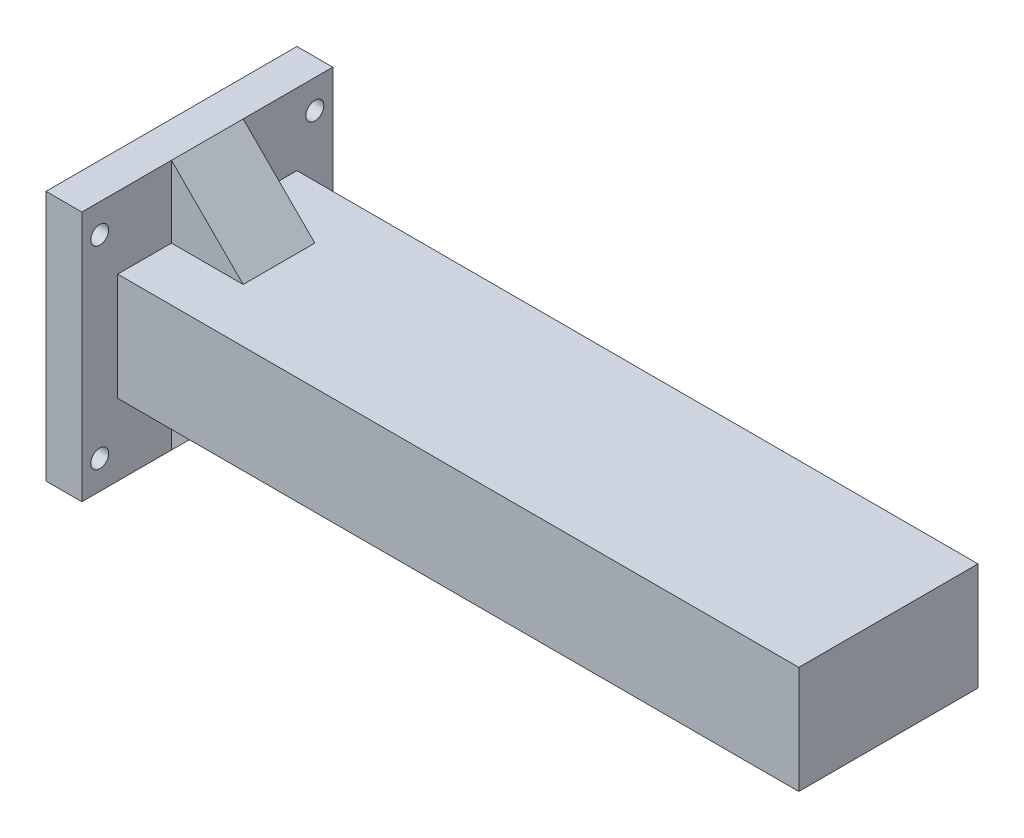
from build123d import *

# Parameters (mm, degrees)
BOSS_EXTRUDE1_DEPTH         = 12.5
SKETCH2_W                   = 5
SKETCH2_H                   = 35
BOSS_EXTRUDE2_DEPTH         = 17.5
TAP_DRILL_FOR_M3X0_5_TAP1_D = 2.5
RIB1_REACH                  = 57.79
SKETCH5_WALL_W              = 127.721703646
SKETCH5_WALL_H              = 10
RIB6_REACH                  = 57.79
SKETCH7_WALL_W              = 127.721703646
SKETCH7_WALL_H              = 10


with BuildPart() as part:
    # Sketch1 → Boss-Extrude1 (new, symmetric)
    with BuildSketch(Plane.XY):
        Polygon((-50, 17.5), (-50, -17.5), (-45, -17.5), (-45, -7.5), (50, -7.5), (50, 7.5), (-45, 7.5), (-45, 17.5), align=None)
    extrude(amount=BOSS_EXTRUDE1_DEPTH, both=True)

    # Sketch2 → Boss-Extrude2 (add, symmetric)
    with BuildSketch(Plane.XY):
        with Locations((-47.5, 0)):
            Rectangle(SKETCH2_W, SKETCH2_H)
    extrude(amount=BOSS_EXTRUDE2_DEPTH, both=True)

    # Tap Drill for M3x0.5 Tap1 (through all)
    with Locations(Plane.ZY.offset(50)):
        with Locations((-15, 13.5), (15, 13.5), (15, -13.5), (-15, -13.5)):
            Hole(TAP_DRILL_FOR_M3X0_5_TAP1_D / 2)

    # Sketch5 wall → Rib1 (add, up to next)
    with BuildSketch(Plane(origin=(-40, 12.5, 0), x_dir=(0.707106781187, -0.707106781187, 0), z_dir=(0.707106781187, 0.707106781187, 0)), mode=Mode.PRIVATE) as rib1_sk1:
        Rectangle(SKETCH5_WALL_W, SKETCH5_WALL_H)
    rib1_tool1 = extrude(rib1_sk1.sketch, amount=-RIB1_REACH, mode=Mode.PRIVATE) - part.part
    add(rib1_tool1.solids().sort_by_distance((-40, 12.5, 0))[0])

    # Sketch7 wall → Rib6 (add, up to next)
    with BuildSketch(Plane(origin=(-40, -12.5, 0), x_dir=(0.707106781187, 0.707106781187, 0), z_dir=(-0.707106781187, 0.707106781187, 0)), mode=Mode.PRIVATE) as rib6_sk1:
        Rectangle(SKETCH7_WALL_W, SKETCH7_WALL_H)
    rib6_tool1 = extrude(rib6_sk1.sketch, amount=RIB6_REACH, mode=Mode.PRIVATE) - part.part
    add(rib6_tool1.solids().sort_by_distance((-40, -12.5, 0))[0])


solid = part.part
